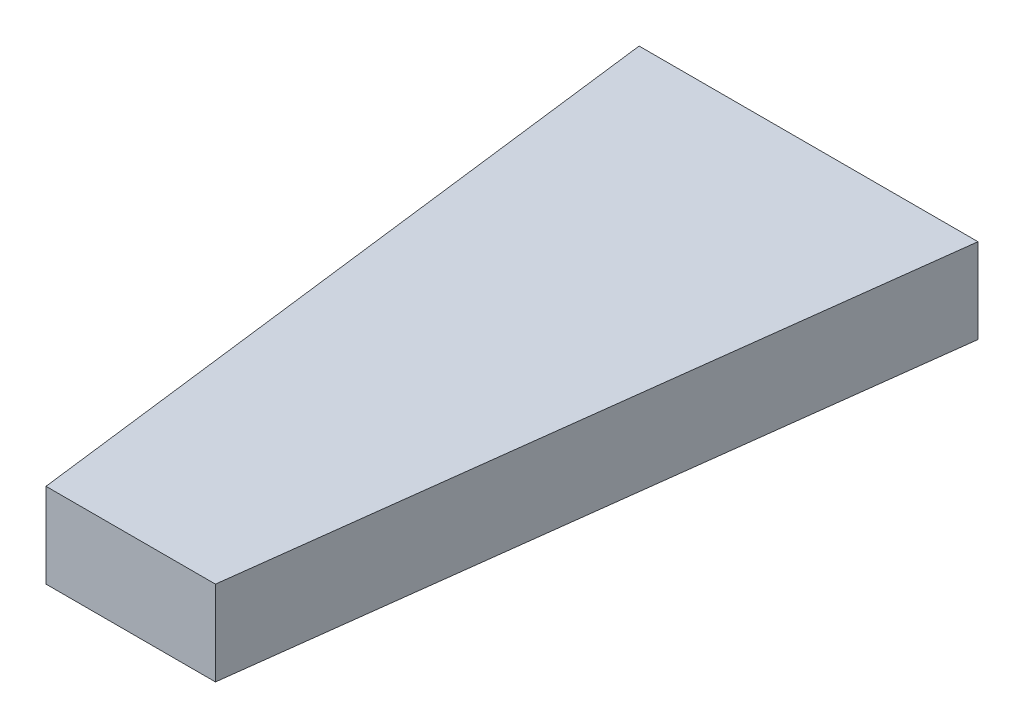
from build123d import *

# Parameters (mm, degrees)
BOSS_EXTRUDE1_DEPTH = 12.7


with BuildPart() as part:
    # Sketch1 → Boss-Extrude1 (new body)
    with BuildSketch(Plane(origin=(0, 0, 0), x_dir=(1, 0, 0), z_dir=(0, 1, 0))):
        Polygon((-25.4, 0), (25.4, 0), (12.7, -101.6), (-12.7, -101.6), align=None)
    extrude(amount=BOSS_EXTRUDE1_DEPTH)


solid = part.part
